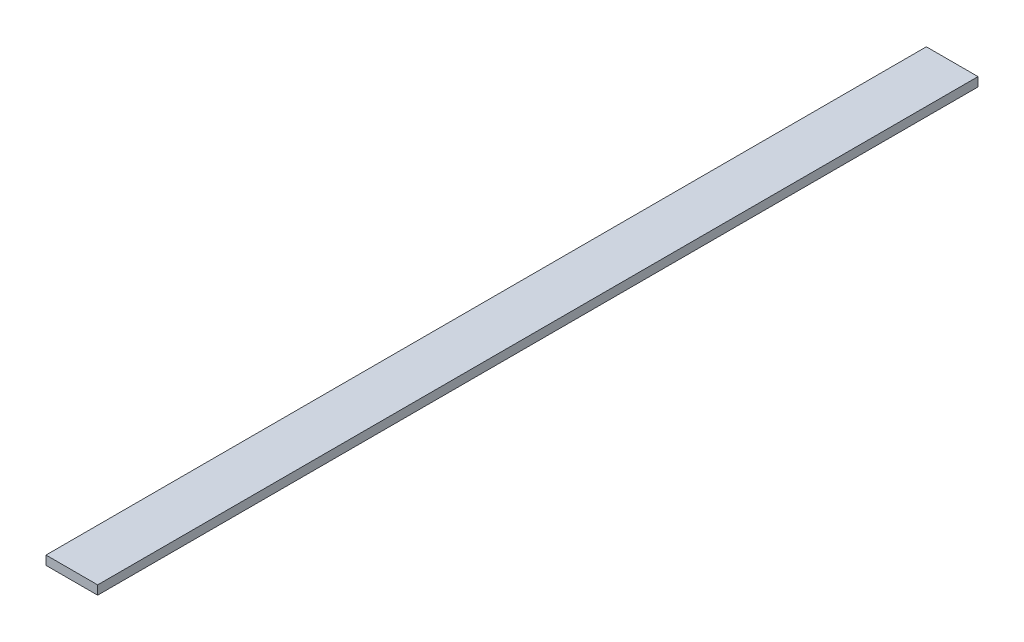
from build123d import *

# Parameters (mm, degrees)
SKETCH1_W           = 115
SKETCH1_H           = 20
BOSS_EXTRUDE1_DEPTH = 1960


with BuildPart() as part:
    # Sketch1 → Boss-Extrude1 (new body)
    with BuildSketch(Plane.XY):
        Rectangle(SKETCH1_W, SKETCH1_H)
    extrude(amount=BOSS_EXTRUDE1_DEPTH)


solid = part.part
